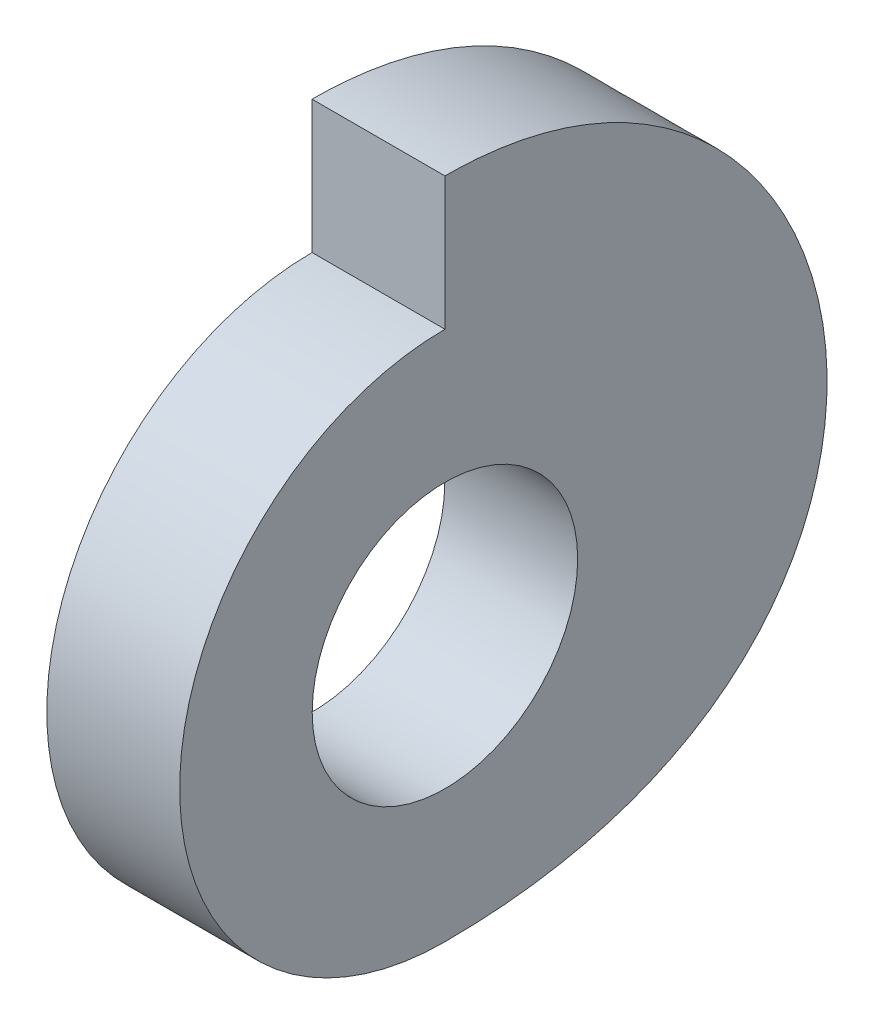
from build123d import *

# Parameters (mm, degrees)
BOSS_EXTRUDE1_DEPTH = 12.7
SKETCH2_R           = 12.688539965
CUT_EXTRUDE1_DEPTH  = 12.7


with BuildPart() as part:
    # Sketch1 → Boss-Extrude1 (new body)
    with BuildSketch(Plane(origin=(0, 0, 0), x_dir=(0, 0, -1), z_dir=(1, 0, 0))):
        with BuildLine():
            Line((0, 25.355286684), (0, 38.049000646))
            add(Edge.make_bspline(
                [(0, -25.355286684), (55.820093588, -25.355286684), (41.028839812, 38.049000646), (0, 38.049000646)],
                knots=[0, 0, 0, 0, 1, 1, 1, 1], degree=3))
            ThreePointArc((0, -25.355286684), (-25.355286684, 0), (0, 25.355286684))
        make_face()
    extrude(amount=BOSS_EXTRUDE1_DEPTH)

    # Sketch2 → Cut-Extrude1 (cut)
    with BuildSketch(Plane(origin=(12.7, 0, 0), x_dir=(0, 0, -1), z_dir=(1, 0, 0))):
        Circle(SKETCH2_R)
    extrude(amount=-CUT_EXTRUDE1_DEPTH, mode=Mode.SUBTRACT)


solid = part.part
